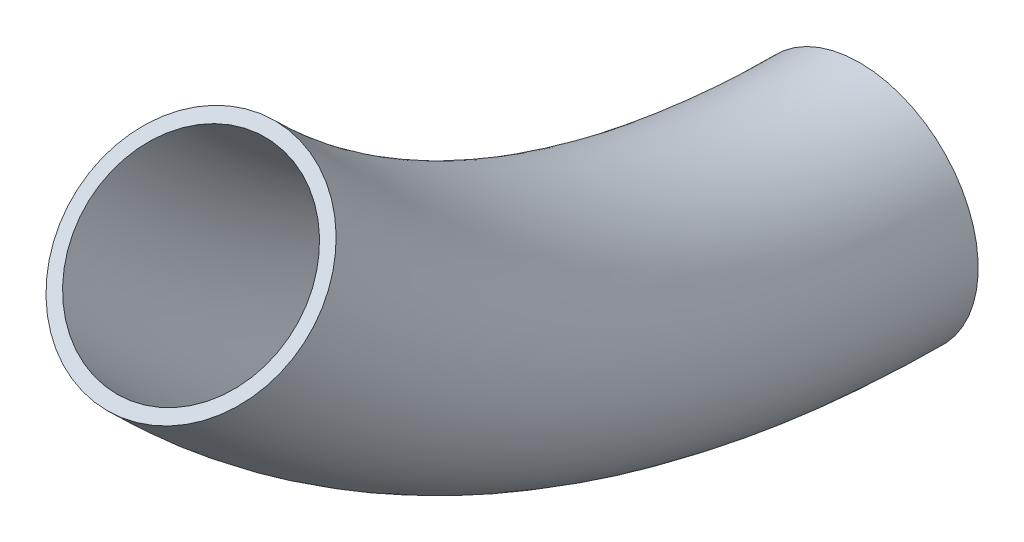
from build123d import *

# Parameters (mm, degrees)
SKETCH1_R   = 17.5
SKETCH1_R_2 = 15.5


with BuildPart() as part:
    # Sweep1: sweep along a path in Sketch2
    with BuildLine(Plane(origin=(0, 0, 0), x_dir=(0, 0, -1), z_dir=(1, 0, 0))) as sweep1_path:
        ThreePointArc((0, 0), (-53.460875501, 10.634029308), (-98.782817332, 40.917182668))
    # Sketch1 → Sweep1 (sweep)
    with BuildSketch(Plane.XY):
        Circle(SKETCH1_R)
        Circle(SKETCH1_R_2, mode=Mode.SUBTRACT)
    sweep(path=sweep1_path.line)


solid = part.part
